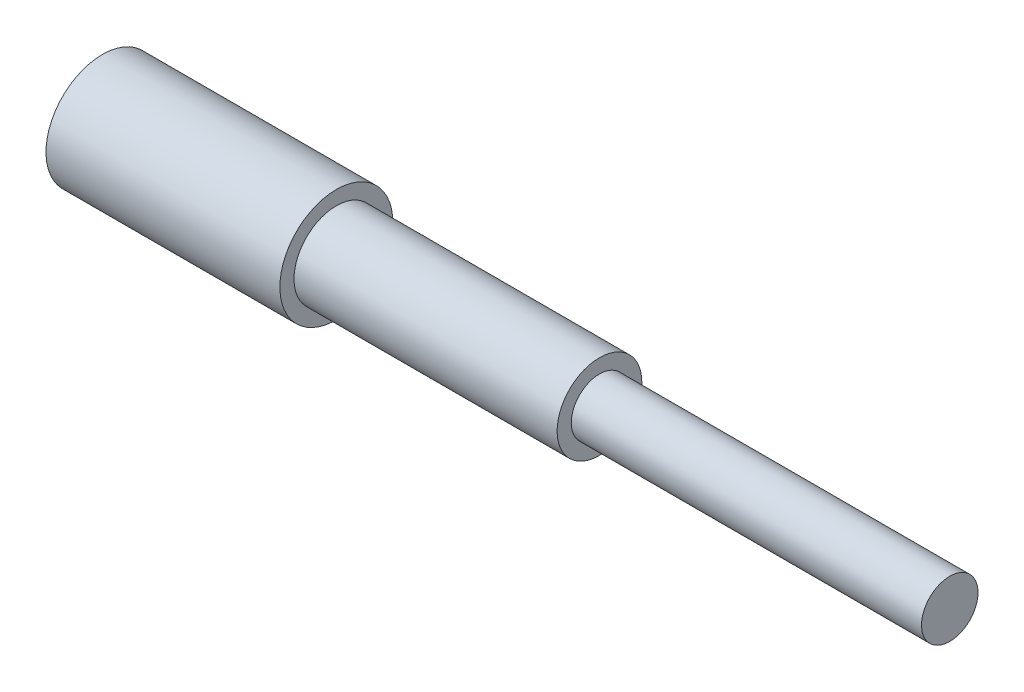
from build123d import *


with BuildPart() as part:
    # Çizim1 → Döndür1 (revolve)
    with BuildSketch(Plane.XY):
        Polygon((-124.699839546, 0), (-124.699839546, 20), (-41.888287939, 20), (-41.888287939, 15), (51.274707618, 15), (51.274707618, 10), (175.300160454, 10), (175.300160454, 0), align=None)
    revolve(axis=Axis((175.300160454, 0, 0), (-1, 0, 0)))


solid = part.part
